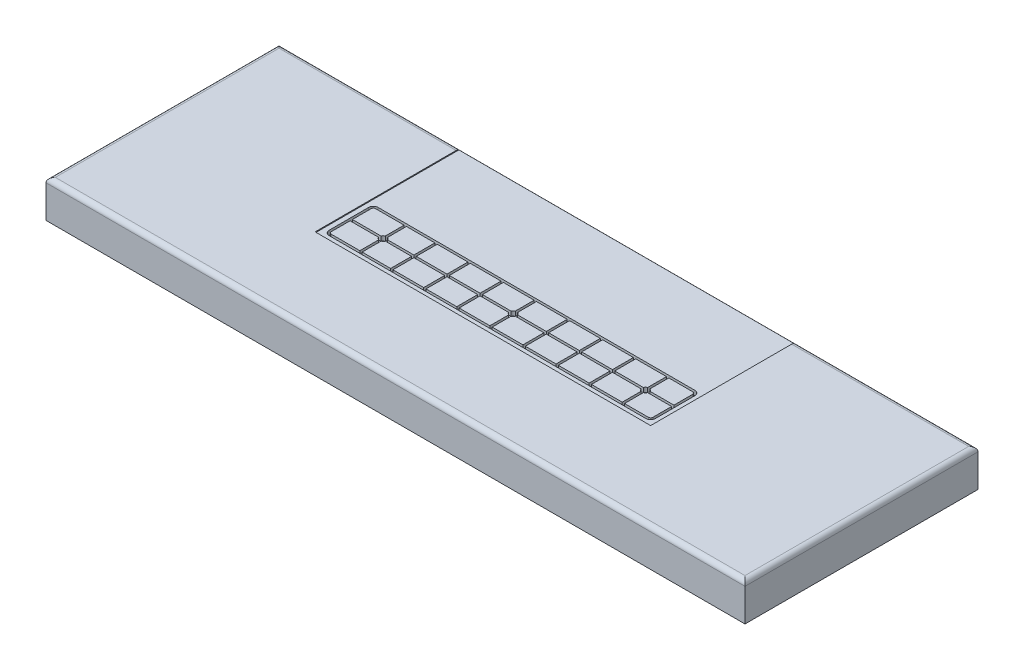
from build123d import *

# Parameters (mm, degrees)
SKETCH1_W               = 1500
SKETCH1_H               = 500
BOSS_EXTRUDE1_DEPTH     = 80
FILLET2_R               = 10
CUT_EXTRUDE2_START      = 80
SKETCH7_W               = 720
SKETCH7_H               = 439.016917436
CUT_EXTRUDE2_DEPTH      = 2
CUT_EXTRUDE1_START      = 78
SKETCH5_W               = 66
SKETCH5_H               = 45
CUT_EXTRUDE1_DEPTH      = 10
CUT_EXTRUDE3_START      = 80
SKETCH8_R               = 5
CUT_EXTRUDE3_DEPTH      = 875.606821013
CUT_EXTRUDE4_DEPTH      = 100
CUT_EXTRUDE4_DEPTH_BACK = 100
SKETCH9_W               = 1310.383503898
SKETCH9_H               = 40
BOSS_EXTRUDE2_START     = 40
SKETCH10_W              = 50
SKETCH10_H              = 200
BOSS_EXTRUDE2_DEPTH     = 40


with BuildPart() as part:
    # Sketch1 → Boss-Extrude1 (new body)
    with BuildSketch(Plane(origin=(0, 0, 0), x_dir=(1, 0, 0), z_dir=(0, 1, 0))):
        Rectangle(SKETCH1_W, SKETCH1_H)
    extrude(amount=BOSS_EXTRUDE1_DEPTH)

    # Fillet2
    fillet2_edges = [part.edges().sort_by_distance(p)[0] for p in [
        (-750, 80, 0),
        (0, 80, 250),
        (750, 80, 0),
        (0, 80, -250),
    ]]
    fillet(fillet2_edges, radius=FILLET2_R)

    # Sketch7 → Cut-Extrude2 (cut)
    with BuildSketch(Plane(origin=(0, 0, 0), x_dir=(1, 0, 0), z_dir=(0, 1, 0)).offset(CUT_EXTRUDE2_START)):
        with Locations((0, 157.008458718)):
            Rectangle(SKETCH7_W, SKETCH7_H)
    extrude(amount=-CUT_EXTRUDE2_DEPTH, mode=Mode.SUBTRACT)

    # Sketch5 → Cut-Extrude1 (cut)
    with BuildSketch(Plane(origin=(0, 0, 0), x_dir=(1, 0, 0), z_dir=(0, 1, 0)).offset(CUT_EXTRUDE1_START)):
        with BuildLine():
            Line((-340, 52.5), (340, 52.5))
            ThreePointArc((340, 52.5), (347.071067812, 49.571067812), (350, 42.5))
            Line((350, 42.5), (350, -42.5))
            ThreePointArc((350, -42.5), (347.071067812, -49.571067812), (340, -52.5))
            Line((340, -52.5), (-340, -52.5))
            ThreePointArc((-340, -52.5), (-347.071067812, -49.571067812), (-350, -42.5))
            Line((-350, -42.5), (-350, 42.5))
            ThreePointArc((-350, 42.5), (-347.071067812, 49.571067812), (-340, 52.5))
        make_face()
        with BuildLine():
            Line((-340, 47.5), (-279, 47.5))
            Line((-279, 47.5), (-279, 7.071067812))
            ThreePointArc((-279, 7.071067812), (-281.803300859, 5.303300859), (-283.571067812, 2.5))
            Line((-283.571067812, 2.5), (-345, 2.5))
            Line((-345, 2.5), (-345, 42.5))
            ThreePointArc((-345, 42.5), (-343.535533906, 46.035533906), (-340, 47.5))
        make_face(mode=Mode.SUBTRACT)
        with BuildLine():
            Line((-340, -47.5), (-279, -47.5))
            Line((-279, -47.5), (-279, -7.071067812))
            ThreePointArc((-279, -7.071067812), (-281.803300859, -5.303300859), (-283.571067812, -2.5))
            Line((-283.571067812, -2.5), (-345, -2.5))
            Line((-345, -2.5), (-345, -42.5))
            ThreePointArc((-345, -42.5), (-343.535533906, -46.035533906), (-340, -47.5))
        make_face(mode=Mode.SUBTRACT)
        with BuildLine():
            Line((345, 42.5), (345, 2.5))
            Line((345, 2.5), (293.571067812, 2.5))
            ThreePointArc((293.571067812, 2.5), (291.803300859, 5.303300859), (289, 7.071067812))
            Line((289, 7.071067812), (289, 47.5))
            Line((289, 47.5), (340, 47.5))
            ThreePointArc((340, 47.5), (343.535533906, 46.035533906), (345, 42.5))
        make_face(mode=Mode.SUBTRACT)
        with Locations((-175, -25)):
            Rectangle(SKETCH5_W, SKETCH5_H, mode=Mode.SUBTRACT)
        with BuildLine():
            Line((0, 47.5), (0, 7.071067812))
            ThreePointArc((0, 7.071067812), (-2.803300859, 5.303300859), (-4.571067812, 2.5))
            Line((-4.571067812, 2.5), (-66, 2.5))
            Line((-66, 2.5), (-66, 47.5))
            Line((-66, 47.5), (0, 47.5))
        make_face(mode=Mode.SUBTRACT)
        with BuildLine():
            Line((5, 47.5), (5, 7.071067812))
            ThreePointArc((5, 7.071067812), (7.803300859, 5.303300859), (9.571067812, 2.5))
            Line((9.571067812, 2.5), (71, 2.5))
            Line((71, 2.5), (71, 47.5))
            Line((71, 47.5), (5, 47.5))
        make_face(mode=Mode.SUBTRACT)
        with Locations((-104, 25)):
            Rectangle(SKETCH5_W, SKETCH5_H, mode=Mode.SUBTRACT)
        with Locations((109, 25)):
            Rectangle(SKETCH5_W, SKETCH5_H, mode=Mode.SUBTRACT)
        with Locations((180, 25)):
            Rectangle(SKETCH5_W, SKETCH5_H, mode=Mode.SUBTRACT)
        with BuildLine():
            Line((218, 47.5), (218, 2.5))
            Line((218, 2.5), (279.428932188, 2.5))
            ThreePointArc((279.428932188, 2.5), (281.196699141, 5.303300859), (284, 7.071067812))
            Line((284, 7.071067812), (284, 47.5))
            Line((284, 47.5), (218, 47.5))
        make_face(mode=Mode.SUBTRACT)
        with Locations((-175, 25)):
            Rectangle(SKETCH5_W, SKETCH5_H, mode=Mode.SUBTRACT)
        with BuildLine():
            Line((-213, 47.5), (-213, 2.5))
            Line((-213, 2.5), (-269.428932188, 2.5))
            ThreePointArc((-269.428932188, 2.5), (-271.196699141, 5.303300859), (-274, 7.071067812))
            Line((-274, 7.071067812), (-274, 47.5))
            Line((-274, 47.5), (-213, 47.5))
        make_face(mode=Mode.SUBTRACT)
        with BuildLine():
            Line((-274, -7.071067812), (-274, -47.5))
            Line((-274, -47.5), (-213, -47.5))
            Line((-213, -47.5), (-213, -2.5))
            Line((-213, -2.5), (-269.428932188, -2.5))
            ThreePointArc((-269.428932188, -2.5), (-271.196699141, -5.303300859), (-274, -7.071067812))
        make_face(mode=Mode.SUBTRACT)
        with Locations((-104, -25)):
            Rectangle(SKETCH5_W, SKETCH5_H, mode=Mode.SUBTRACT)
        with BuildLine():
            Line((-66, -2.5), (-4.571067812, -2.5))
            ThreePointArc((-4.571067812, -2.5), (-2.803300859, -5.303300859), (0, -7.071067812))
            Line((0, -7.071067812), (0, -47.5))
            Line((0, -47.5), (-66, -47.5))
            Line((-66, -47.5), (-66, -2.5))
        make_face(mode=Mode.SUBTRACT)
        with BuildLine():
            Line((5, -7.071067812), (5, -47.5))
            Line((5, -47.5), (71, -47.5))
            Line((71, -47.5), (71, -2.5))
            Line((71, -2.5), (9.571067812, -2.5))
            ThreePointArc((9.571067812, -2.5), (7.803300859, -5.303300859), (5, -7.071067812))
        make_face(mode=Mode.SUBTRACT)
        with Locations((109, -25)):
            Rectangle(SKETCH5_W, SKETCH5_H, mode=Mode.SUBTRACT)
        with Locations((180, -25)):
            Rectangle(SKETCH5_W, SKETCH5_H, mode=Mode.SUBTRACT)
        with BuildLine():
            Line((218, -2.5), (218, -47.5))
            Line((218, -47.5), (284, -47.5))
            Line((284, -47.5), (284, -7.071067812))
            ThreePointArc((284, -7.071067812), (281.196699141, -5.303300859), (279.428932188, -2.5))
            Line((279.428932188, -2.5), (218, -2.5))
        make_face(mode=Mode.SUBTRACT)
        with BuildLine():
            Line((289, -7.071067812), (289, -47.5))
            Line((289, -47.5), (340, -47.5))
            ThreePointArc((340, -47.5), (343.535533906, -46.035533906), (345, -42.5))
            Line((345, -42.5), (345, -2.5))
            Line((345, -2.5), (293.571067812, -2.5))
            ThreePointArc((293.571067812, -2.5), (291.803300859, -5.303300859), (289, -7.071067812))
        make_face(mode=Mode.SUBTRACT)
    extrude(amount=-CUT_EXTRUDE1_DEPTH, mode=Mode.SUBTRACT)

    # Sketch8 → Cut-Extrude3 (cut, through all)
    with BuildSketch(Plane(origin=(0, 0, 0), x_dir=(1, 0, 0), z_dir=(0, 1, 0)).offset(CUT_EXTRUDE3_START)):
        with Locations(Location((-276.5, 0, 0), (0, 0, 270))):
            Circle(SKETCH8_R)
        with Locations(Location((2.5, 0, 0), (0, 0, 270))):
            Circle(SKETCH8_R)
        with Locations(Location((286.5, 0, 0), (0, 0, 270))):
            Circle(SKETCH8_R)
    extrude(amount=-CUT_EXTRUDE3_DEPTH, mode=Mode.SUBTRACT)

    # Sketch9 → Cut-Extrude4 (cut, two sides: drawn at the far end of the back side and taken through both)
    with BuildSketch(Plane.XY.offset(-CUT_EXTRUDE4_DEPTH_BACK)):
        with Locations((-274.195529116, 20)):
            Rectangle(SKETCH9_W, SKETCH9_H)
    extrude(amount=CUT_EXTRUDE4_DEPTH + CUT_EXTRUDE4_DEPTH_BACK, mode=Mode.SUBTRACT)

    # Sketch10 → Boss-Extrude2 (add)
    with BuildSketch(Plane(origin=(0, 0, 0), x_dir=(1, 0, 0), z_dir=(0, 1, 0)).offset(BOSS_EXTRUDE2_START)):
        with Locations((-137, 0)):
            Rectangle(SKETCH10_W, SKETCH10_H)
        with Locations((144.5, 0)):
            Rectangle(SKETCH10_W, SKETCH10_H)
        with Locations((-416, 0)):
            Rectangle(SKETCH10_W, SKETCH10_H)
    extrude(amount=-BOSS_EXTRUDE2_DEPTH)


solid = part.part
